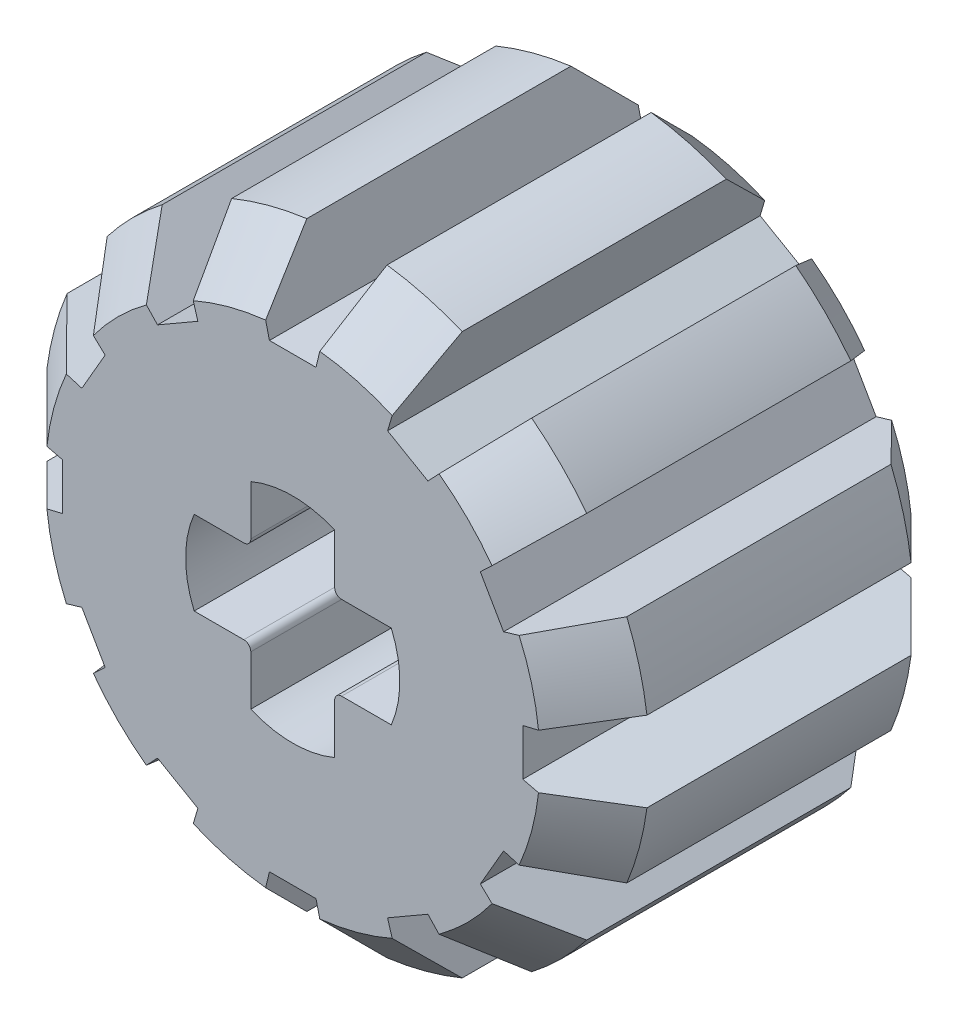
from build123d import *

# Parameters (mm, degrees)
SKETCH2_R           = 6.5
BOSS_EXTRUDE1_DEPTH = 8
CUT_EXTRUDE1_DEPTH  = 13.186057607
CIRPATTERN1_COUNT   = 12


with BuildPart() as part:
    # Sketch2 → Boss-Extrude1 (new body)
    with BuildSketch(Plane.XY):
        Circle(SKETCH2_R)
        with BuildLine():
            Line((-0.9, 2.116601049), (-0.9, 1.05))
            ThreePointArc((-0.9, 1.05), (-0.943933983, 0.943933983), (-1.05, 0.9))
            Line((-1.05, 0.9), (-2.116601049, 0.9))
            ThreePointArc((-2.116601049, 0.9), (-2.3, 0), (-2.116601049, -0.9))
            Line((-2.116601049, -0.9), (-1.05, -0.9))
            ThreePointArc((-1.05, -0.9), (-0.943933983, -0.943933983), (-0.9, -1.05))
            Line((-0.9, -1.05), (-0.9, -2.116601049))
            ThreePointArc((-0.9, -2.116601049), (0, -2.3), (0.9, -2.116601049))
            Line((0.9, -2.116601049), (0.9, -1.05))
            ThreePointArc((0.9, -1.05), (0.943933983, -0.943933983), (1.05, -0.9))
            Line((1.05, -0.9), (2.116601049, -0.9))
            ThreePointArc((2.116601049, -0.9), (2.3, 0), (2.116601049, 0.9))
            Line((2.116601049, 0.9), (1.05, 0.9))
            ThreePointArc((1.05, 0.9), (0.943933983, 0.943933983), (0.9, 1.05))
            Line((0.9, 1.05), (0.9, 2.116601049))
            ThreePointArc((0.9, 2.116601049), (0, 2.3), (-0.9, 2.116601049))
        make_face(mode=Mode.SUBTRACT)
    extrude(amount=BOSS_EXTRUDE1_DEPTH)

    # Sketch3 → Cut-Extrude1 (cut, through all)
    with BuildSketch(Plane.XY.offset(8)):
        Polygon((-0.875, 6.5), (-0.5, 4.94), (0, 4.94), (0.5, 4.94), (0.875, 6.5), align=None)
    cut_extrude1 = extrude(amount=-CUT_EXTRUDE1_DEPTH, mode=Mode.SUBTRACT)

    # CirPattern1: Cut-Extrude1 ×12 about axis
    cirpattern1_axis = Axis((0, 0, 0), (0, 0, 1))
    for i in range(1, CIRPATTERN1_COUNT):
        add(cut_extrude1.rotate(cirpattern1_axis, i * 360 / CIRPATTERN1_COUNT), mode=Mode.SUBTRACT)

    # Sketch4 → Cut-Revolve1 (revolve, cut)
    with BuildSketch(Plane(origin=(0, 0, 0), x_dir=(1, 0, 0), z_dir=(0, 1, 0))):
        Polygon((-6.812692974, -8.45), (-6.812692974, -6.53), (-4.85, -8.45), align=None)
        Polygon((-4.85, 0.45), (-6.812692974, 0.45), (-6.812692974, -1.47), align=None)
    revolve(axis=Axis((0, 0, -4.663745267), (0, 0, 1)), mode=Mode.SUBTRACT)


solid = part.part
